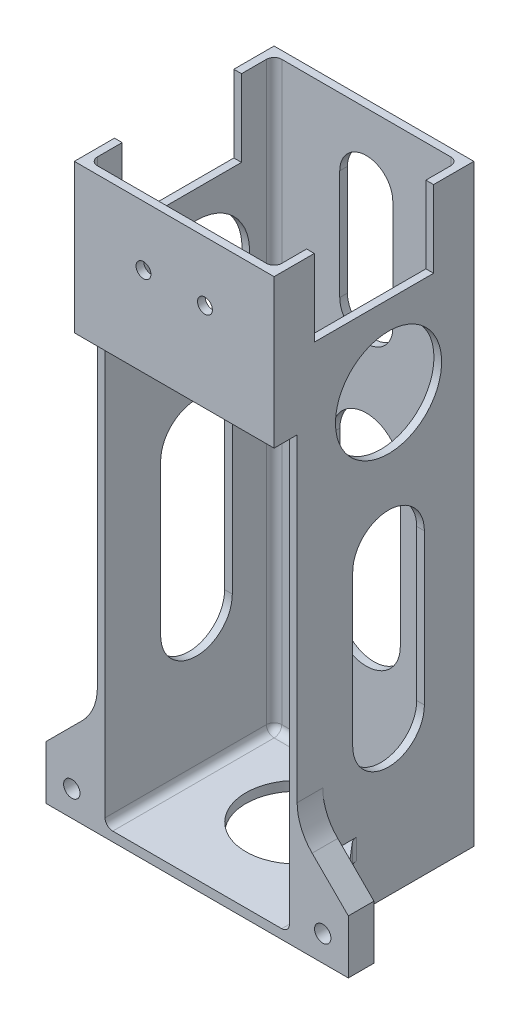
from build123d import *

# Parameters (mm, degrees)
SKETCH1_W       = 39
SKETCH1_H       = 39
EXTRUDE1_DEPTH  = 150
SKETCH2_W       = 36
SKETCH2_H       = 36
EXTRUDE2_DEPTH  = 112
SKETCH3_W       = 4.5
SKETCH3_H       = 120
EXTRUDE3_DEPTH  = 158.167148993
SKETCH8_W       = 36
SKETCH8_H       = 33
EXTRUDE6_DEPTH  = 2
FILLET1_R       = 1.5
SKETCH11_W      = 23.29
SKETCH11_H      = 15
EXTRUDE8_DEPTH  = 158.167148993
EXTRUDE9_DEPTH  = 1.5
SKETCH14_R      = 1.45
EXTRUDE11_DEPTH = 1.5
SKETCH15_R      = 10.365721684
EXTRUDE12_DEPTH = 158.167148993
SKETCH17_W      = 4.5
SKETCH17_H      = 1
EXTRUDE14_DEPTH = 158.167148993
SKETCH18_W      = 34.5
SKETCH18_H      = 34.16
EXTRUDE15_DEPTH = 158.167148993
SKETCH19_W      = 5
SKETCH19_H      = 10.5
EXTRUDE16_DEPTH = 10
SKETCH20_W      = 5
SKETCH20_H      = 10.5
EXTRUDE17_DEPTH = 10
SKETCH21_R      = 1.6
EXTRUDE18_DEPTH = 10
SKETCH22_R      = 1.6
EXTRUDE19_DEPTH = 10
EXTRUDE20_DEPTH = 5
SKETCH25_R      = 10
EXTRUDE21_DEPTH = 5
EXTRUDE23_DEPTH = 4
FILLET2_R       = 10
FILLET3_R       = 2


with BuildPart() as part:
    # Sketch1 → Extrude1 (new body)
    with BuildSketch(Plane(origin=(0, 0, 0), x_dir=(1, 0, 0), z_dir=(0, 1, 0))):
        with Locations((-11.707942094, -6.586638776)):
            Rectangle(SKETCH1_W, SKETCH1_H)
    extrude(amount=EXTRUDE1_DEPTH)

    # Sketch2 → Extrude2 (cut)
    with BuildSketch(Plane(origin=(0, 150, 0), x_dir=(1, 0, 0), z_dir=(0, 1, 0))):
        with Locations((-11.707942094, -6.586638776)):
            Rectangle(SKETCH2_W, SKETCH2_H)
    extrude(amount=-EXTRUDE2_DEPTH, mode=Mode.SUBTRACT)

    # Sketch3 → Extrude3 (cut, through all)
    with BuildSketch(Plane.ZY.offset(31.207942094)):
        with Locations((23.836638776, 60)):
            Rectangle(SKETCH3_W, SKETCH3_H)
    extrude(amount=-EXTRUDE3_DEPTH, mode=Mode.SUBTRACT)

    # Sketch8 → Extrude6 (cut)
    with BuildSketch(Plane(origin=(0, 38, 0), x_dir=(1, 0, 0), z_dir=(0, 1, 0))):
        with Locations((-11.707942094, -5.086638776)):
            Rectangle(SKETCH8_W, SKETCH8_H)
    extrude(amount=-EXTRUDE6_DEPTH, mode=Mode.SUBTRACT)

    # Fillet1
    fillet1_edges = [part.edges().sort_by_distance(p)[0] for p in [
        (-29.707942094, 93, -11.413361224),
        (6.292057906, 93, -11.413361224),
        (6.292057906, 135, 24.586638776),
        (-29.707942094, 135, 24.586638776),
        (6.292057906, 36, 5.086638776),
        (-29.707942094, 36, 5.086638776),
        (-11.707942094, 36, -11.413361224),
    ]]
    fillet(fillet1_edges, radius=FILLET1_R)

    # Sketch11 → Extrude8 (cut, through all)
    with BuildSketch(Plane.ZY.offset(31.207942094)):
        with BuildLine():
            Line((-3.255937041, 62.910708566), (-3.255937041, 92.357092416))
            ThreePointArc((-3.255937041, 92.357092416), (3.739612713, 99.352642171), (10.735162468, 92.357092416))
            Line((10.735162468, 92.357092416), (10.735162468, 62.910708566))
            ThreePointArc((10.735162468, 62.910708566), (3.739612713, 55.915158812), (-3.255937041, 62.910708566))
        make_face()
        with Locations((6.591638776, 142.5)):
            Rectangle(SKETCH11_W, SKETCH11_H)
    extrude(amount=-EXTRUDE8_DEPTH, mode=Mode.SUBTRACT)

    # Sketch12 → Extrude9 (cut)
    with BuildSketch(Plane(origin=(0, 0, -12.913361224), x_dir=(-1, 0, 0), z_dir=(0, 0, -1))):
        with BuildLine():
            Line((5.065703237, 62.27828297), (5.065703237, 91.808021534))
            ThreePointArc((5.065703237, 91.808021534), (11.707942094, 98.450260391), (18.350180951, 91.808021534))
            Line((18.350180951, 91.808021534), (18.350180951, 62.27828297))
            ThreePointArc((18.350180951, 62.27828297), (11.707942094, 55.636044113), (5.065703237, 62.27828297))
        make_face()
        with BuildLine():
            Line((6.527758749, 115.3801061), (6.527758749, 136.80161472))
            ThreePointArc((6.527758749, 136.80161472), (11.707942094, 141.981798065), (16.888125439, 136.80161472))
            Line((16.888125439, 136.80161472), (16.888125439, 115.3801061))
            ThreePointArc((16.888125439, 115.3801061), (11.707942094, 110.199922755), (6.527758749, 115.3801061))
        make_face()
    extrude(amount=-EXTRUDE9_DEPTH, mode=Mode.SUBTRACT)

    # Sketch14 → Extrude11 (cut)
    with BuildSketch(Plane.XY.offset(26.086638776)):
        with Locations((-5.707942094, 138.35)):
            Circle(SKETCH14_R)
        with Locations((-17.707942094, 138.35)):
            Circle(SKETCH14_R)
    extrude(amount=-EXTRUDE11_DEPTH, mode=Mode.SUBTRACT)

    # Sketch15 → Extrude12 (cut, through all)
    with BuildSketch(Plane.ZY.offset(31.207942094)):
        with Locations((3.739612713, 119.241924714)):
            Circle(SKETCH15_R)
    extrude(amount=-EXTRUDE12_DEPTH, mode=Mode.SUBTRACT)

    # Sketch17 → Extrude14 (cut, through all)
    with BuildSketch(Plane.ZY.offset(31.207942094)):
        with Locations((23.836638776, 120.5)):
            Rectangle(SKETCH17_W, SKETCH17_H)
    extrude(amount=-EXTRUDE14_DEPTH, mode=Mode.SUBTRACT)

    # Sketch18 → Extrude15 (cut, through all)
    with BuildSketch(Plane.ZY.offset(31.207942094)):
        with Locations((4.336638776, 17.08)):
            Rectangle(SKETCH18_W, SKETCH18_H)
    extrude(amount=-EXTRUDE15_DEPTH, mode=Mode.SUBTRACT)

    # Sketch19 → Extrude16 (add)
    with BuildSketch(Plane.ZY.offset(31.207942094)):
        with Locations((19.086638776, 39.41)):
            Rectangle(SKETCH19_W, SKETCH19_H)
    extrude(amount=EXTRUDE16_DEPTH)

    # Sketch20 → Extrude17 (add)
    with BuildSketch(Plane(origin=(7.792057906, 0, 0), x_dir=(0, 0, -1), z_dir=(1, 0, 0))):
        with Locations((-19.086638776, 39.41)):
            Rectangle(SKETCH20_W, SKETCH20_H)
    extrude(amount=EXTRUDE17_DEPTH)

    # Sketch21 → Extrude18 (cut)
    with BuildSketch(Plane(origin=(0, 0, 16.586638776), x_dir=(-1, 0, 0), z_dir=(0, 0, -1))):
        with Locations((-12.792057906, 39.16)):
            Circle(SKETCH21_R)
    extrude(amount=-EXTRUDE18_DEPTH, mode=Mode.SUBTRACT)

    # Sketch22 → Extrude19 (cut)
    with BuildSketch(Plane(origin=(0, 0, 16.586638776), x_dir=(-1, 0, 0), z_dir=(0, 0, -1))):
        with Locations((36.207942094, 39.16)):
            Circle(SKETCH22_R)
    extrude(amount=-EXTRUDE19_DEPTH, mode=Mode.SUBTRACT)

    # Sketch24 → Extrude20 (add)
    with BuildSketch(Plane(origin=(0, 0, 16.586638776), x_dir=(-1, 0, 0), z_dir=(0, 0, -1))):
        Polygon((-17.792057906, 44.66), (-7.792057906, 44.66), (-7.792057906, 54.66), align=None)
        Polygon((41.207942094, 44.66), (31.207942094, 44.66), (31.207942094, 54.66), align=None)
    extrude(amount=-EXTRUDE20_DEPTH)

    # Sketch25 → Extrude21 (cut)
    with BuildSketch(Plane(origin=(0, 34.16, 0), x_dir=(-1, 0, 0), z_dir=(0, -1, 0))):
        with Locations(Location((11.707942094, -2.086638776, 0), (0, 0, 90))):
            Circle(SKETCH25_R)
    extrude(amount=-EXTRUDE21_DEPTH, mode=Mode.SUBTRACT)

    # Sketch31 → Extrude23 (add)
    with BuildSketch(Plane(origin=(0, 43.16, 0), x_dir=(-1, 0, 0), z_dir=(0, -1, 0))):
        Polygon((-12.792057906, -16.586638776), (-7.792057906, -16.586638776), (-7.792057906, -10.735162468), align=None)
        Polygon((36.207942094, -16.586638776), (31.207942094, -16.586638776), (31.207942094, -11.586638776), align=None)
    extrude(amount=-EXTRUDE23_DEPTH)

    # Fillet2
    fillet2_edges = [part.edges().sort_by_distance(p)[0] for p in [
        (7.792057906, 54.66, 19.086638776),
        (-31.207942094, 54.66, 19.086638776),
    ]]
    fillet(fillet2_edges, radius=FILLET2_R)

    # Fillet3
    fillet3_edges = [part.edges().sort_by_distance(p)[0] for p in [
        (7.792057906, 45.16, 10.735162468),
        (12.792057906, 45.16, 16.586638776),
        (-31.207942094, 45.16, 11.586638776),
        (-36.207942094, 45.16, 16.586638776),
    ]]
    fillet(fillet3_edges, radius=FILLET3_R)


solid = part.part
